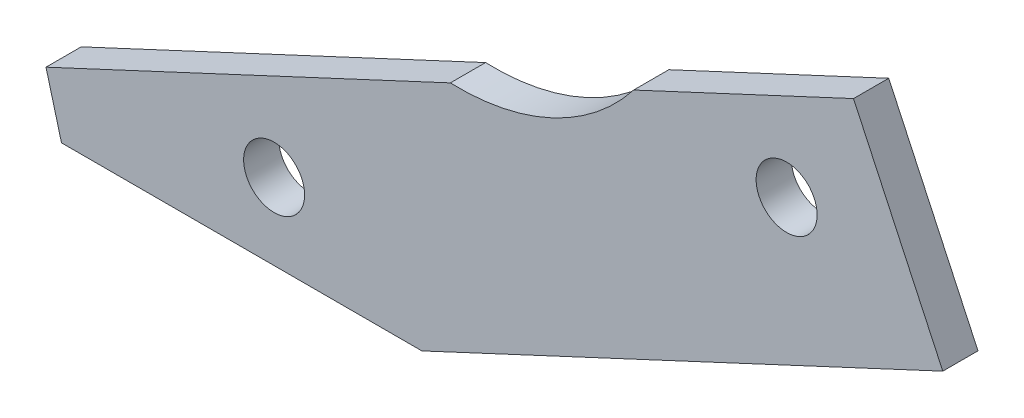
from build123d import *

# Parameters (mm, degrees)
SKETCH3_R           = 2.75
BOSS_EXTRUDE1_DEPTH = 3.175


with BuildPart() as part:
    # Sketch3 → Boss-Extrude1 (new body)
    with BuildSketch(Plane.XY):
        with BuildLine():
            Line((-151.387366014, 162.94696479), (-171.218095931, 153.699743563))
            ThreePointArc((-171.218095931, 153.699743563), (-178.553147236, 147.851921545), (-187.747718893, 145.99185379))
            Line((-187.747718893, 145.99185379), (-224.213491791, 128.987584627))
            Line((-224.213491791, 128.987584627), (-222.816572263, 123.774209976))
            Line((-222.816572263, 123.774209976), (-190.317469649, 123.774209976))
            Line((-190.317469649, 123.774209976), (-143.336488128, 145.681801447))
            Line((-143.336488128, 145.681801447), (-151.387366014, 162.94696479))
        make_face()
        with Locations((-157.41934736, 152.220574699)):
            Circle(SKETCH3_R, mode=Mode.SUBTRACT)
        with Locations((-203.641044499, 130.66704335)):
            Circle(SKETCH3_R, mode=Mode.SUBTRACT)
    extrude(amount=-BOSS_EXTRUDE1_DEPTH)


solid = part.part
